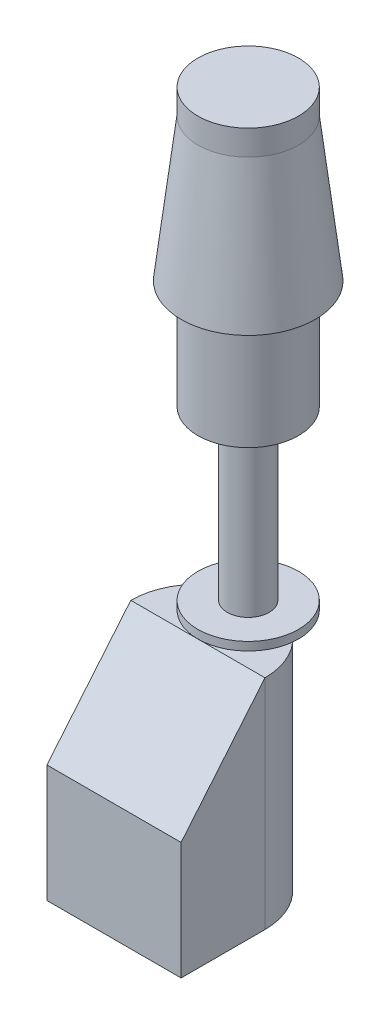
from build123d import *

# Parameters (mm, degrees)
SKETCH1_R           = 38.1
BOSS_EXTRUDE1_DEPTH = 41.275
SKETCH2_R           = 15.875
BOSS_EXTRUDE2_DEPTH = 127
SKETCH3_R           = 38.1
BOSS_EXTRUDE3_DEPTH = 6.35
BOSS_EXTRUDE4_DEPTH = 165.1
CUT_EXTRUDE1_REACH  = 370.861


with BuildPart() as part:
    # Sketch1 → Boss-Extrude1 (new, symmetric)
    with BuildSketch(Plane(origin=(0, 0, 0), x_dir=(1, 0, 0), z_dir=(0, 1, 0))):
        with Locations(Location((0, 0, 0), (0, 0, 270))):
            Circle(SKETCH1_R)
    extrude(amount=BOSS_EXTRUDE1_DEPTH, both=True)

    # Sketch2 → Boss-Extrude2 (add)
    with BuildSketch(Plane.XZ.offset(41.275)):
        with Locations(Location((0, 0, 0), (0, 0, 270))):
            Circle(SKETCH2_R)
    extrude(amount=BOSS_EXTRUDE2_DEPTH)

    # Sketch3 → Boss-Extrude3 (add)
    with BuildSketch(Plane.XZ.offset(168.275)):
        with Locations(Location((0, 0, 0), (0, 0, 90))):
            Circle(SKETCH3_R)
    extrude(amount=BOSS_EXTRUDE3_DEPTH)

    # Sketch4 → Boss-Extrude4 (add)
    with BuildSketch(Plane.XZ.offset(174.625)):
        with BuildLine():
            Line((-50.8, 38.1), (-50.8, 101.6))
            Line((-50.8, 101.6), (50.8, 101.6))
            Line((50.8, 101.6), (50.8, 38.1))
            ThreePointArc((50.8, 38.1), (0, -12.7), (-50.8, 38.1))
        make_face()
    extrude(amount=BOSS_EXTRUDE4_DEPTH)

    # Cut-Extrude1: up to this face of the body (flat: up to its plane)
    cut_extrude1_end = Plane(part.part.faces().sort_by_distance((-50.8, -257.175, 69.85))[0])
    # Sketch5 → Cut-Extrude1 (cut, up to the picked face)
    with BuildSketch(Plane(origin=(50.8, 0, 0), x_dir=(0, 0, -1), z_dir=(1, 0, 0)), mode=Mode.PRIVATE) as cut_extrude1_sk1:
        Polygon((-38.1, -174.625), (-101.6, -174.625), (-101.6, -250.825), align=None)
    cut_extrude1_tool1 = split(extrude(cut_extrude1_sk1.sketch, amount=-CUT_EXTRUDE1_REACH, mode=Mode.PRIVATE), bisect_by=cut_extrude1_end, keep=Keep.BOTH, mode=Mode.PRIVATE)
    add(cut_extrude1_tool1.solids().sort_by(Axis((50.8, -200.025, 80.433333), (-1, 0, 0)))[0], mode=Mode.SUBTRACT)

    # Sketch6 → Revolve1 (revolve)
    with BuildSketch(Plane.XY, mode=Mode.PRIVATE) as revolve1_sk:
        Polygon((0, 41.275), (50.8, 41.275), (38.1, 149.225), (38.1, 168.275), (0, 168.275), align=None)
    revolve(revolve1_sk.sketch.rotate(Axis((0, 168.275, 0), (0, -1, 0)), 180), axis=Axis((0, 168.275, 0), (0, -1, 0)))


solid = part.part
